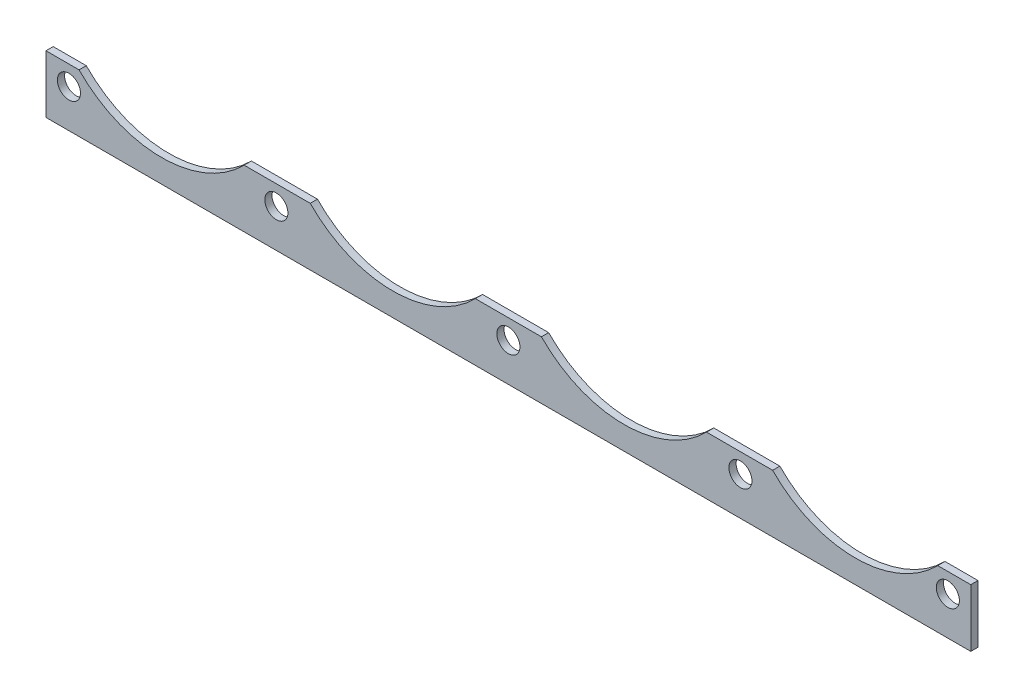
from build123d import *

# Parameters (mm, degrees)
SKETCH1_R           = 2.54
BOSS_EXTRUDE1_DEPTH = 0.79375


with BuildPart() as part:
    # Sketch1 → Boss-Extrude1 (new, symmetric)
    # profile 1 of 2: a face of its own
    with BuildSketch(Plane.XY):
        with BuildLine():
            Line((0, 10.938896076), (0, 12.7))
            Line((0, 12.7), (-7.260771792, 12.7))
            ThreePointArc((-7.260771792, 12.7), (-25.4, 5.08), (-43.539228208, 12.7))
            Line((-43.539228208, 12.7), (-58.060771792, 12.7))
            ThreePointArc((-58.060771792, 12.7), (-76.2, 5.08), (-94.339228208, 12.7))
            Line((-94.339228208, 12.7), (-101.6, 12.7))
            Line((-101.6, 12.7), (-101.6, 0))
            Line((-101.6, 0), (0, 0))
            Line((0, 0), (0, 5.858896076))
            ThreePointArc((0, 5.858896076), (-2.54, 8.398896076), (0, 10.938896076))
        make_face()
        with Locations((-96.562042846, 8.398896076)):
            Circle(SKETCH1_R, mode=Mode.SUBTRACT)
        with Locations((-50.984733006, 8.398896076)):
            Circle(SKETCH1_R, mode=Mode.SUBTRACT)
    # profile 2 of 2: a face of its own
    with BuildSketch(Plane.XY):
        with BuildLine():
            Line((7.260771792, 12.7), (0, 12.7))
            Line((0, 12.7), (0, 10.938896076))
            ThreePointArc((0, 10.938896076), (1.796051224, 10.1949473), (2.54, 8.398896076))
            ThreePointArc((2.54, 8.398896076), (1.796051224, 6.602844851), (0, 5.858896076))
            Line((0, 5.858896076), (0, 0))
            Line((0, 0), (101.6, 0))
            Line((101.6, 0), (101.6, 12.7))
            Line((101.6, 12.7), (94.339228208, 12.7))
            ThreePointArc((94.339228208, 12.7), (76.2, 5.08), (58.060771792, 12.7))
            Line((58.060771792, 12.7), (43.539228208, 12.7))
            ThreePointArc((43.539228208, 12.7), (25.4, 5.08), (7.260771792, 12.7))
        make_face()
        with Locations((50.984733006, 8.398896076)):
            Circle(SKETCH1_R, mode=Mode.SUBTRACT)
        with Locations((96.562042846, 8.398896076)):
            Circle(SKETCH1_R, mode=Mode.SUBTRACT)
    extrude(amount=BOSS_EXTRUDE1_DEPTH, both=True)


solid = part.part
